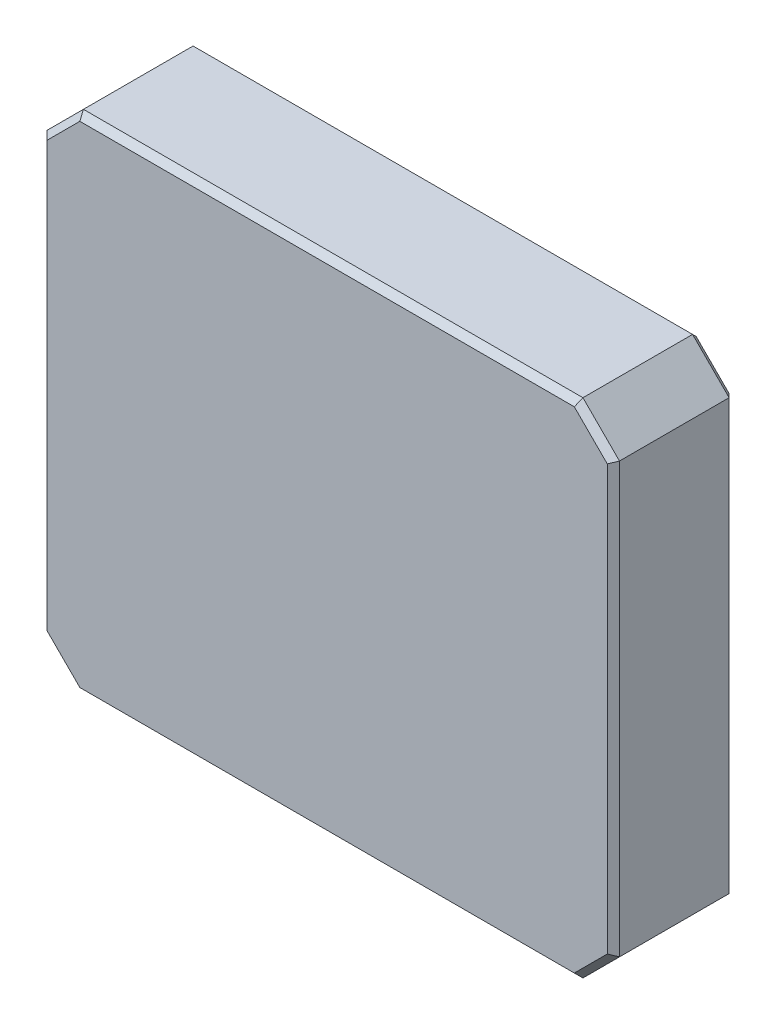
from build123d import *

# Parameters (mm, degrees)
BOSS_EXTRUDE1_DEPTH = 20
CHAMFER1_SIZE       = 1


with BuildPart() as part:
    # Sketch1 → Boss-Extrude1 (new body)
    with BuildSketch(Plane.XY):
        Polygon((-47, 35.25), (-41, 41.25), (41, 41.25), (47, 35.25), (47, -35.25), (41, -41.25), (-41, -41.25), (-47, -35.25), align=None)
    extrude(amount=BOSS_EXTRUDE1_DEPTH)

    # Chamfer1
    chamfer1_edges = [part.edges().sort_by_distance(p)[0] for p in [
        (44, -38.25, 0),
        (0, -41.25, 0),
        (-44, -38.25, 0),
        (-47, 0, 0),
        (0, -41.25, 20),
        (44, -38.25, 20),
        (47, 0, 20),
        (44, 38.25, 20),
        (0, 41.25, 20),
        (-44, 38.25, 20),
        (-47, 0, 20),
        (-44, 38.25, 0),
        (-44, -38.25, 20),
        (0, 41.25, 0),
        (44, 38.25, 0),
        (47, 0, 0),
    ]]
    chamfer(chamfer1_edges, length=CHAMFER1_SIZE)


solid = part.part
